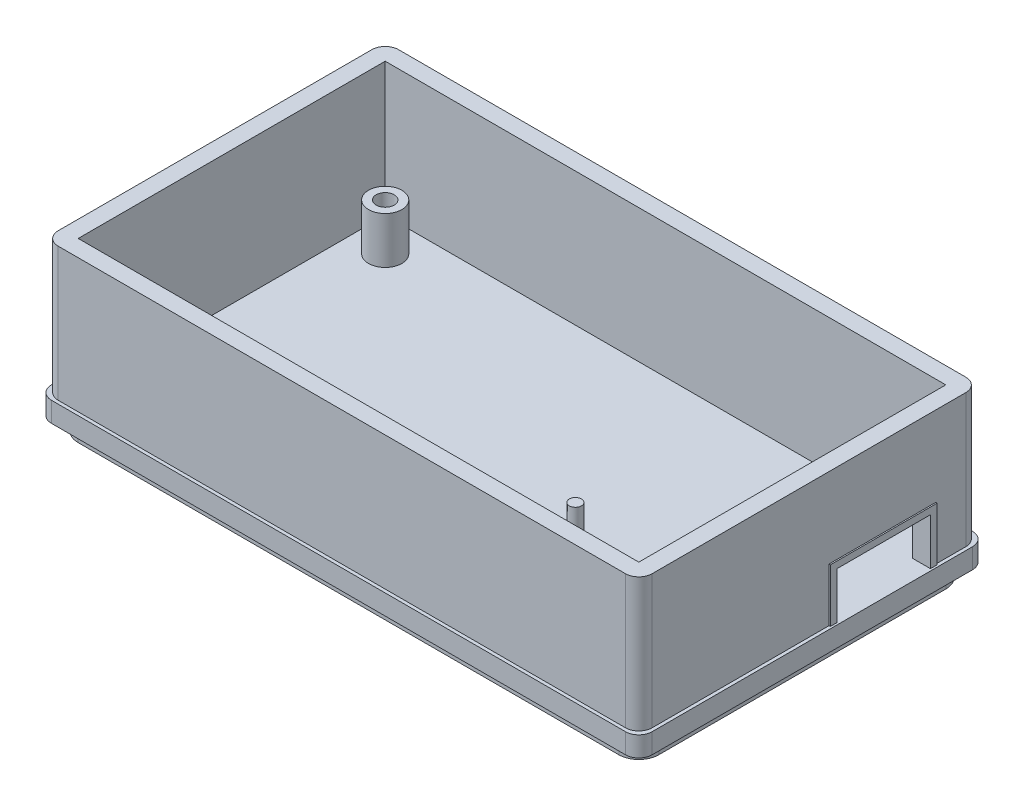
from build123d import *

# Parameters (mm, degrees)
SKETCH1_W               = 90
SKETCH1_H               = 52
BOSS_EXTRUDE1_DEPTH     = 3
BOSS_EXTRUDE2_START     = 3
SKETCH4_R               = 2.5
BOSS_EXTRUDE2_DEPTH     = 7
CUT_EXTRUDE2_DEPTH      = 53.92447449
CUT_EXTRUDE2_DEPTH_BACK = 63.92447449
CUT_EXTRUDE2_START      = 10
SKETCH5_R               = 1.35
BOSS_EXTRUDE3_START     = 10
SKETCH6_R               = 0.9
BOSS_EXTRUDE3_DEPTH     = 12.5
SKETCH7_W               = 87
SKETCH7_H               = 49
SKETCH7_W_2             = 81
SKETCH7_H_2             = 43
BOSS_EXTRUDE4_DEPTH     = 2
FILLET1_R               = 3
BOSS_EXTRUDE8_START     = 3
SKETCH8_W               = 89
SKETCH8_H               = 51
SKETCH8_W_2             = 84
SKETCH8_H_2             = 46
BOSS_EXTRUDE8_DEPTH     = 20
FILLET2_R               = 2
CUT_EXTRUDE3_START      = 42
SKETCH9_W               = 14
SKETCH9_H               = 7
CUT_EXTRUDE3_DEPTH      = 15
BOSS_EXTRUDE9_START     = 44.5
BOSS_EXTRUDE9_DEPTH     = 0.2


with BuildPart() as part:
    # Sketch1 → Boss-Extrude1 (new body)
    with BuildSketch(Plane(origin=(0, 0, 0), x_dir=(1, 0, 0), z_dir=(0, 1, 0))):
        Rectangle(SKETCH1_W, SKETCH1_H)
    extrude(amount=BOSS_EXTRUDE1_DEPTH)

    # Sketch4 → Boss-Extrude2 (add)
    with BuildSketch(Plane(origin=(0, 0, 0), x_dir=(1, 0, 0), z_dir=(0, 1, 0)).offset(BOSS_EXTRUDE2_START)):
        with Locations(Location((29, -19.5, 0), (0, 0, 270))):
            Circle(SKETCH4_R)
        with Locations(Location((-37, 18, 0), (0, 0, 270))):
            Circle(SKETCH4_R)
        with Locations(Location((-37, -16.5, 0), (0, 0, 270))):
            Circle(SKETCH4_R)
    extrude(amount=BOSS_EXTRUDE2_DEPTH)

    # Sketch5 → Cut-Extrude2 (cut, two sides: drawn at the far end of the back side and taken through both)
    with BuildSketch(Plane(origin=(0, 0, 0), x_dir=(1, 0, 0), z_dir=(0, 1, 0)).offset(CUT_EXTRUDE2_START - CUT_EXTRUDE2_DEPTH_BACK)):
        with Locations(Location((-37, 18, 0), (0, 0, 270))):
            Circle(SKETCH5_R)
        with Locations(Location((-37, -16.5, 0), (0, 0, 270))):
            Circle(SKETCH5_R)
    extrude(amount=CUT_EXTRUDE2_DEPTH + CUT_EXTRUDE2_DEPTH_BACK, mode=Mode.SUBTRACT)

    # Sketch6 → Boss-Extrude3 (add)
    with BuildSketch(Plane(origin=(0, 0, 0), x_dir=(1, 0, 0), z_dir=(0, 1, 0)).offset(BOSS_EXTRUDE3_START)):
        with Locations(Location((29, -19.5, 0), (0, 0, 270))):
            Circle(SKETCH6_R)
    extrude(amount=BOSS_EXTRUDE3_DEPTH)

    # Sketch7 → Boss-Extrude4 (add)
    with BuildSketch(Plane(origin=(0, 0, 0), x_dir=(1, 0, 0), z_dir=(0, 1, 0))):
        Rectangle(SKETCH7_W, SKETCH7_H)
        Rectangle(SKETCH7_W_2, SKETCH7_H_2, mode=Mode.SUBTRACT)
    extrude(amount=-BOSS_EXTRUDE4_DEPTH)

    # Fillet1
    fillet1_edges = [part.edges().sort_by_distance(p)[0] for p in [
        (43.5, -1, -24.5),
        (43.5, -1, 24.5),
        (-43.5, -1, 24.5),
        (-43.5, -1, -24.5),
    ]]
    fillet(fillet1_edges, radius=FILLET1_R)

    # Sketch8 → Boss-Extrude8 (add)
    with BuildSketch(Plane(origin=(0, 0, 0), x_dir=(1, 0, 0), z_dir=(0, 1, 0)).offset(BOSS_EXTRUDE8_START)):
        Rectangle(SKETCH8_W, SKETCH8_H)
        Rectangle(SKETCH8_W_2, SKETCH8_H_2, mode=Mode.SUBTRACT)
    extrude(amount=BOSS_EXTRUDE8_DEPTH)

    # Fillet2
    fillet2_edges = [part.edges().sort_by_distance(p)[0] for p in [
        (44.5, 13, -25.5),
        (-44.5, 13, -25.5),
        (-44.5, 13, 25.5),
        (44.5, 13, 25.5),
        (-45, 1.5, -26),
        (45, 1.5, -26),
        (45, 1.5, 26),
        (-45, 1.5, 26),
    ]]
    fillet(fillet2_edges, radius=FILLET2_R)

    # Sketch9 → Cut-Extrude3 (cut)
    with BuildSketch(Plane(origin=(0, 0, 0), x_dir=(0, 0, -1), z_dir=(1, 0, 0)).offset(CUT_EXTRUDE3_START)):
        with Locations((11, 6.5)):
            Rectangle(SKETCH9_W, SKETCH9_H)
    extrude(amount=CUT_EXTRUDE3_DEPTH, mode=Mode.SUBTRACT)

    # Sketch10 → Boss-Extrude9 (add)
    with BuildSketch(Plane(origin=(0, 0, 0), x_dir=(0, 0, -1), z_dir=(1, 0, 0)).offset(BOSS_EXTRUDE9_START)):
        Polygon((18, 3), (18, 10), (4, 10), (4, 3), (3, 3), (3, 11), (19, 11), (19, 3), align=None)
    extrude(amount=BOSS_EXTRUDE9_DEPTH)


solid = part.part
